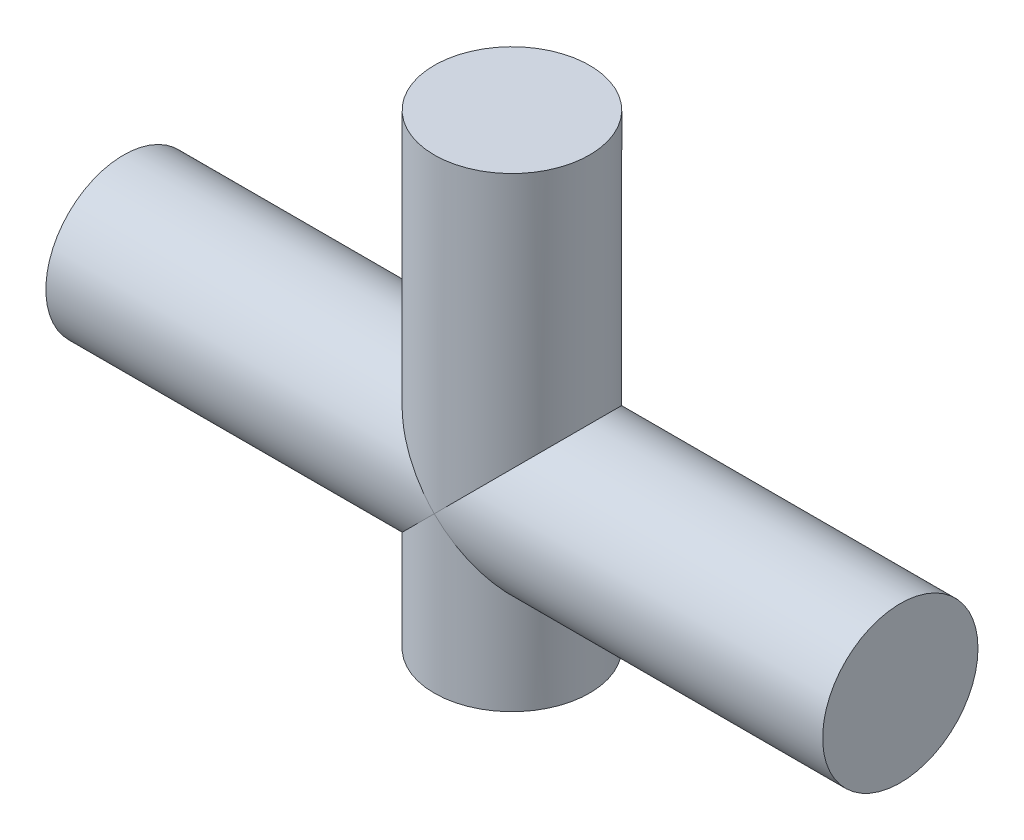
from build123d import *

# Parameters (mm, degrees)
BOSS_EXTRUDE1_DEPTH      = 31.75
BOSS_EXTRUDE1_DEPTH_BACK = 31.75
SKETCH2_R                = 6.35
BOSS_EXTRUDE2_DEPTH      = 25.4
BOSS_EXTRUDE2_DEPTH_BACK = 12.7
SKETCH1_R                = 6.35


with BuildPart() as part:
    # Sketch2 → Boss-Extrude1 (new, two sides: drawn at the far end of the back side and taken through both)
    with BuildSketch(Plane(origin=(0, 0, 0), x_dir=(0, 0, -1), z_dir=(1, 0, 0)).offset(-BOSS_EXTRUDE1_DEPTH_BACK)):
        Circle(SKETCH2_R)
    extrude(amount=BOSS_EXTRUDE1_DEPTH + BOSS_EXTRUDE1_DEPTH_BACK)

    # Sketch1 → Boss-Extrude2 (add, two sides: drawn at the far end of the back side and taken through both)
    with BuildSketch(Plane(origin=(0, 0, 0), x_dir=(1, 0, 0), z_dir=(0, 1, 0)).offset(-BOSS_EXTRUDE2_DEPTH_BACK)):
        Circle(SKETCH1_R)
    extrude(amount=BOSS_EXTRUDE2_DEPTH + BOSS_EXTRUDE2_DEPTH_BACK)


solid = part.part
